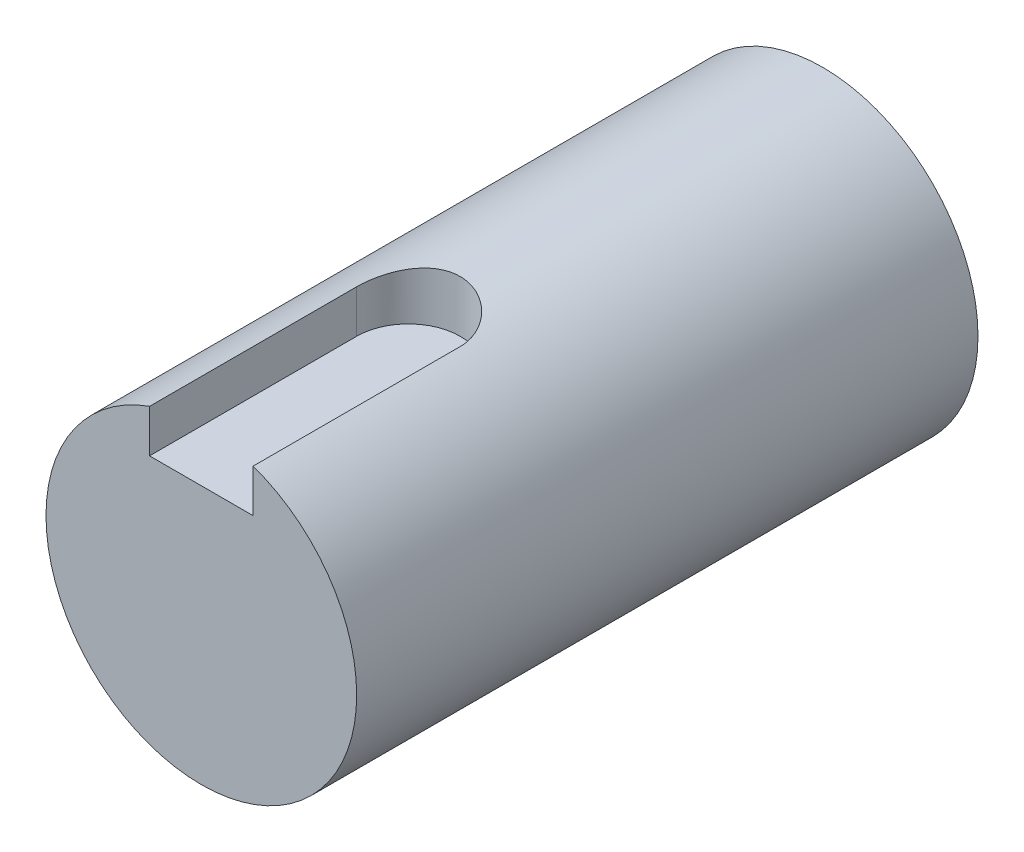
from build123d import *

# Parameters (mm, degrees)
SKETCH2_R           = 15
BOSS_EXTRUDE1_DEPTH = 30
CUT_EXTRUDE1_DEPTH  = 5


with BuildPart() as part:
    # Sketch2 → Boss-Extrude1 (new, symmetric)
    with BuildSketch(Plane.XY):
        Circle(SKETCH2_R)
    extrude(amount=BOSS_EXTRUDE1_DEPTH, both=True)

    # Sketch3 → Cut-Extrude1 (cut)
    with BuildSketch(Plane(origin=(0, 15, 0), x_dir=(1, 0, 0), z_dir=(0, 1, 0))):
        with BuildLine():
            Line((-5, -30), (-5, -10))
            ThreePointArc((-5, -10), (0, -5), (5, -10))
            Line((5, -10), (5, -30))
            ThreePointArc((5, -30), (0, -35), (-5, -30))
        make_face()
    extrude(amount=-CUT_EXTRUDE1_DEPTH, mode=Mode.SUBTRACT)


solid = part.part
